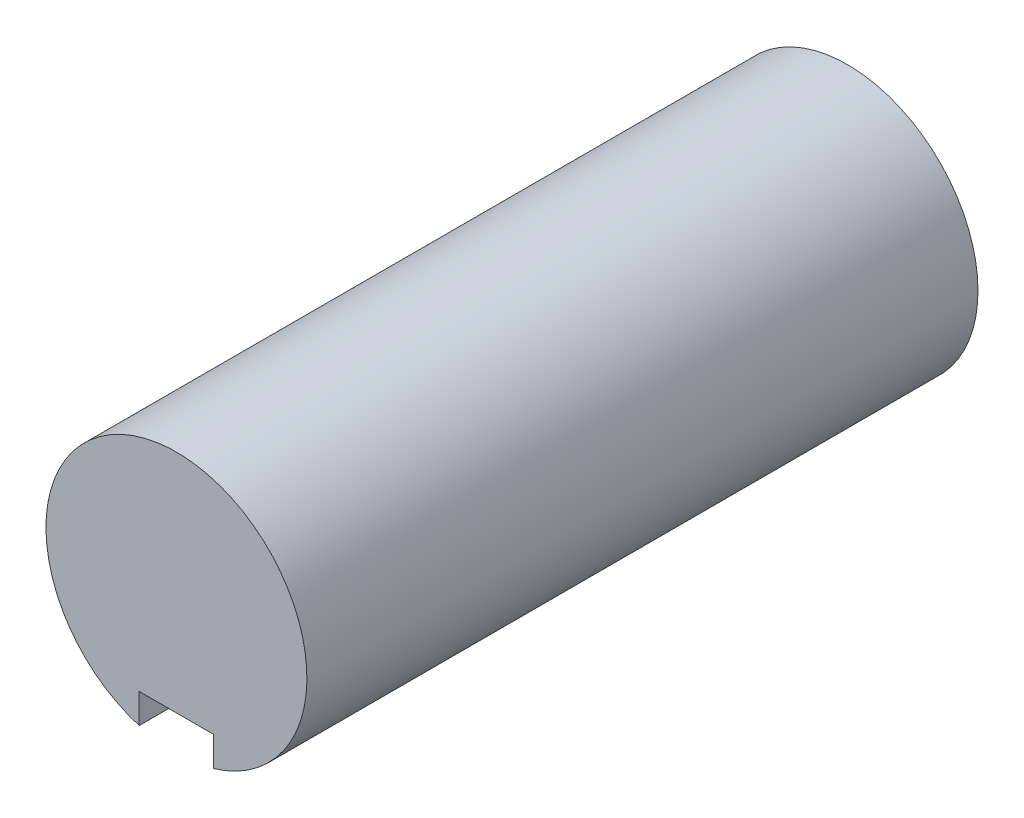
from build123d import *

# Parameters (mm, degrees)
BOSS_EXTRUDE1_DEPTH = 90
BOSS_EXTRUDE2_DEPTH = 38


with BuildPart() as part:
    # Sketch1 → Boss-Extrude1 (new body)
    with BuildSketch(Plane.XY):
        with BuildLine():
            Line((-5, -16.770509831), (-5, -12.8))
            Line((-5, -12.8), (5, -12.8))
            Line((5, -12.8), (5, -16.770509831))
            ThreePointArc((5, -16.770509831), (0, 17.5), (-5, -16.770509831))
        make_face()
    extrude(amount=BOSS_EXTRUDE1_DEPTH)

    # Sketch2 → Boss-Extrude2 (add)
    with BuildSketch(Plane(origin=(0, 0, 0), x_dir=(-1, 0, 0), z_dir=(0, 0, -1))):
        with BuildLine():
            ThreePointArc((-5, -16.770509831), (0, -17.5), (5, -16.770509831))
            Line((5, -16.770509831), (5, -12.8))
            Line((5, -12.8), (-5, -12.8))
            Line((-5, -12.8), (-5, -16.770509831))
        make_face()
    extrude(amount=-BOSS_EXTRUDE2_DEPTH)


solid = part.part
